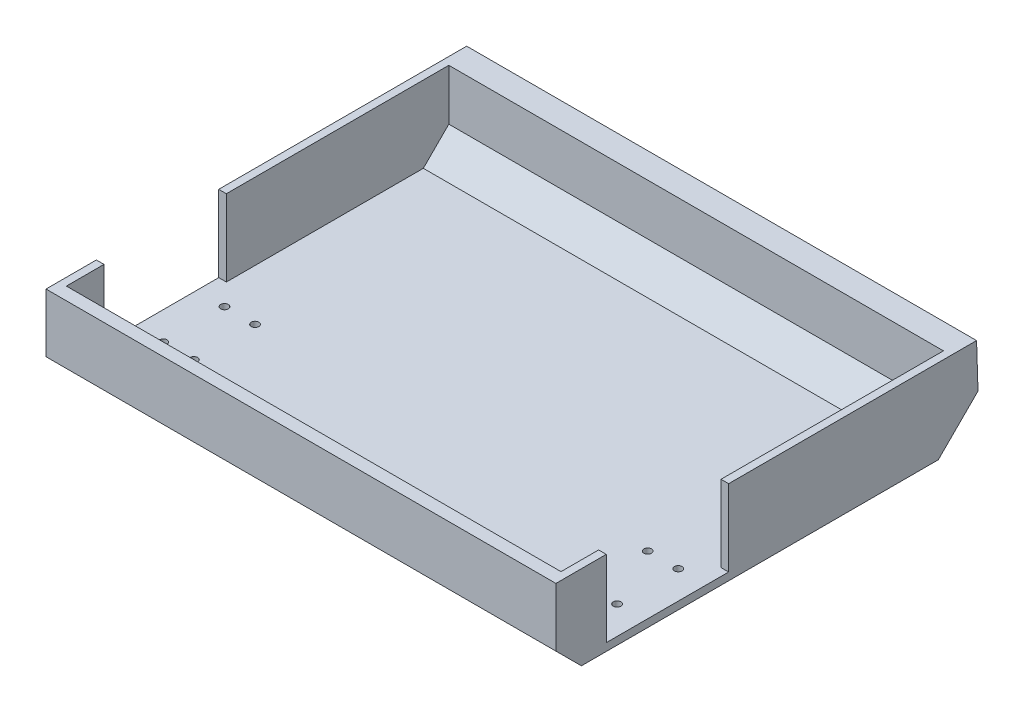
from build123d import *

# Parameters (mm, degrees)
CROQUIS1_W              = 200
CROQUIS1_H              = 150
SALIENTE_EXTRUIR1_DEPTH = 3
CROQUIS2_W              = 3
CROQUIS2_H              = 150
SALIENTE_EXTRUIR2_DEPTH = 30
SALIENTE_EXTRUIR4_DEPTH = 5
CROQUIS6_W              = 200
CROQUIS6_H              = 33
SALIENTE_EXTRUIR5_DEPTH = 5
CHAFL_N1_SIZE           = 10
CHAFL_N2_SIZE           = 10
CROQUIS7_R              = 1.5
CORTAR_EXTRUIR2_DEPTH   = 10
CROQUIS8_W              = 48
CROQUIS8_H              = 30
CORTAR_EXTRUIR3_DEPTH   = 200
SALIENTE_EXTRUIR6_DEPTH = 200


with BuildPart() as part:
    # Croquis1 → Saliente-Extruir1 (new body)
    with BuildSketch(Plane(origin=(0, 0, 0), x_dir=(1, 0, 0), z_dir=(0, 1, 0))):
        with Locations((100, 75)):
            Rectangle(CROQUIS1_W, CROQUIS1_H)
    extrude(amount=SALIENTE_EXTRUIR1_DEPTH)

    # Croquis2 → Saliente-Extruir2 (add)
    with BuildSketch(Plane(origin=(0, 3, 0), x_dir=(1, 0, 0), z_dir=(0, 1, 0))):
        with Locations((1.5, 75)):
            Rectangle(CROQUIS2_W, CROQUIS2_H)
        with Locations((198.5, 75)):
            Rectangle(CROQUIS2_W, CROQUIS2_H)
    extrude(amount=SALIENTE_EXTRUIR2_DEPTH)

    # Croquis5 → Saliente-Extruir4 (add)
    with BuildSketch(Plane.XY):
        Polygon((0, 33), (3, 33), (200, 33), (200, 0), (0, 0), align=None)
    extrude(amount=SALIENTE_EXTRUIR4_DEPTH)

    # Croquis6 → Saliente-Extruir5 (add)
    with BuildSketch(Plane(origin=(0, 0, -150), x_dir=(-1, 0, 0), z_dir=(0, 0, -1))):
        with Locations((-100, 16.5)):
            Rectangle(CROQUIS6_W, CROQUIS6_H)
    extrude(amount=SALIENTE_EXTRUIR5_DEPTH)

    # Chaflán1
    chafl_n1_edges = [part.edges().sort_by_distance(p)[0] for p in [
        (100, 0, 5),
        (100, 0, -155),
    ]]
    chamfer(chafl_n1_edges, length=CHAFL_N1_SIZE)

    # Chaflán2
    chafl_n2_edges = [part.edges().sort_by_distance(p)[0] for p in [
        (100, 3, 0),
        (100, 3, -150),
    ]]
    chamfer(chafl_n2_edges, length=CHAFL_N2_SIZE)

    # Croquis7 → Cortar-Extruir2 (cut)
    with BuildSketch(Plane(origin=(0, 3, 0), x_dir=(1, 0, 0), z_dir=(0, 1, 0))):
        with Locations(Location((189, 30, 0), (0, 0, 270))):
            Circle(CROQUIS7_R)
        with Locations(Location((177, 30, 0), (0, 0, 270))):
            Circle(CROQUIS7_R)
        with Locations(Location((189, 54, 0), (0, 0, 270))):
            Circle(CROQUIS7_R)
        with Locations(Location((177, 54, 0), (0, 0, 270))):
            Circle(CROQUIS7_R)
        with Locations(Location((23, 30, 0), (0, 0, 270))):
            Circle(CROQUIS7_R)
        with Locations(Location((11, 30, 0), (0, 0, 270))):
            Circle(CROQUIS7_R)
        with Locations(Location((23, 54, 0), (0, 0, 270))):
            Circle(CROQUIS7_R)
        with Locations(Location((11, 54, 0), (0, 0, 270))):
            Circle(CROQUIS7_R)
    extrude(amount=-CORTAR_EXTRUIR2_DEPTH, mode=Mode.SUBTRACT)

    # Croquis8 → Cortar-Extruir3 (cut)
    with BuildSketch(Plane(origin=(200, 0, 0), x_dir=(0, 0, -1), z_dir=(1, 0, 0))):
        with Locations((38.75, 18)):
            Rectangle(CROQUIS8_W, CROQUIS8_H)
    extrude(amount=-CORTAR_EXTRUIR3_DEPTH, mode=Mode.SUBTRACT)

    # Croquis9 → Saliente-Extruir6 (add)
    with BuildSketch(Plane(origin=(200, 0, 0), x_dir=(0, 0, -1), z_dir=(1, 0, 0))):
        Polygon((155, 10), (160.560253642, 15.560253642), (160, 33), (155, 33), align=None)
    extrude(amount=-SALIENTE_EXTRUIR6_DEPTH)


solid = part.part
